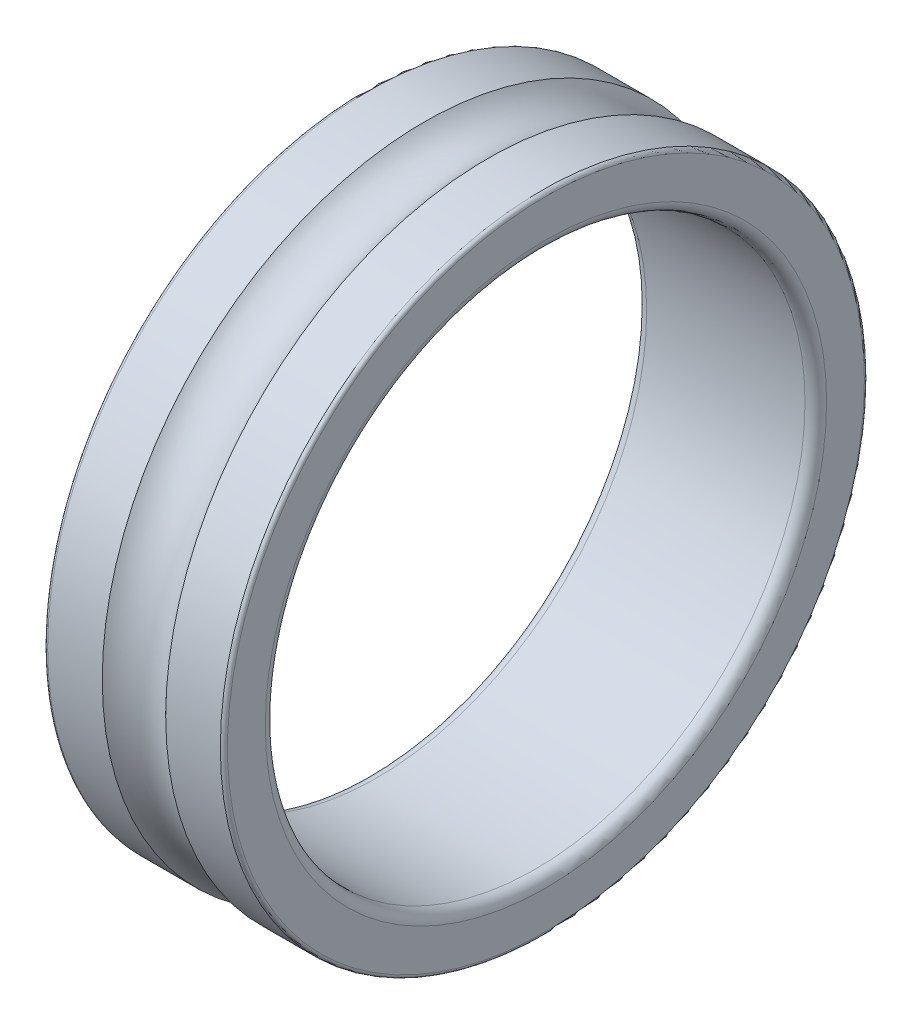
from build123d import *


with BuildPart() as part:
    # Sketch1 → Revolve1 (revolve)
    with BuildSketch(Plane.XY, mode=Mode.PRIVATE) as revolve1_sk:
        with BuildLine():
            Line((0.3, 7.5), (4.7, 7.5))
            ThreePointArc((4.7, 7.5), (4.912132034, 7.587867966), (5, 7.8))
            Line((5, 7.8), (5, 8.85))
            ThreePointArc((5, 8.85), (4.970710678, 8.920710678), (4.9, 8.95))
            Line((4.9, 8.95), (3.381640658, 8.95))
            ThreePointArc((3.381640658, 8.95), (2.5, 8.5595), (1.618359342, 8.95))
            Line((1.618359342, 8.95), (0.1, 8.95))
            ThreePointArc((0.1, 8.95), (0.029289322, 8.920710678), (0, 8.85))
            Line((0, 8.85), (0, 7.8))
            ThreePointArc((0, 7.8), (0.087867966, 7.587867966), (0.3, 7.5))
        make_face()
    revolve(revolve1_sk.sketch.rotate(Axis((4.7, 0, 0), (-1, 0, 0)), 90), axis=Axis((4.7, 0, 0), (-1, 0, 0)))


solid = part.part
